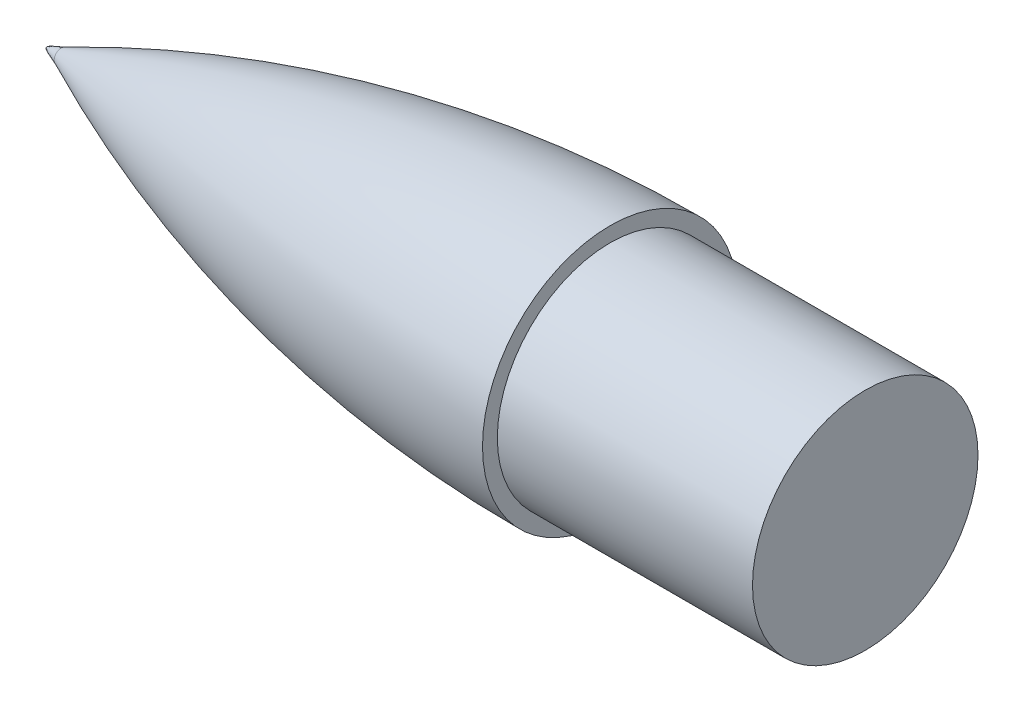
from build123d import *


with BuildPart() as part:
    # Sketch2 → Revolve1 (revolve)
    with BuildSketch(Plane.XY, mode=Mode.PRIVATE) as revolve1_sk:
        with BuildLine():
            Line((0, 441.26744186), (0, 436.26744186))
            Line((0, 436.26744186), (86, 436.26744186))
            Line((86, 436.26744186), (86, 398.26744186))
            Line((86, 398.26744186), (81, 398.26744186))
            Line((81, 398.26744186), (81, 431.26744186))
            Line((81, 431.26744186), (-5, 431.26744186))
            Line((-5, 431.26744186), (-5, 436.23878877))
            ThreePointArc((-5, 436.23878877), (-93.487892601, 426.132954328), (-178.079548465, 398.26744186))
            Line((-178.079548465, 398.26744186), (-190, 398.26744186))
            ThreePointArc((-190, 398.26744186), (-97.402515368, 430.38320744), (0, 441.26744186))
        make_face()
    revolve(revolve1_sk.sketch.rotate(Axis((-190, 398.26744186, 0), (-1, 0, 0)), 90), axis=Axis((-190, 398.26744186, 0), (-1, 0, 0)))

    # Sketch3 → Cut-Revolve1 (revolve, cut)
    with BuildSketch(Plane.XY, mode=Mode.PRIVATE) as cut_revolve1_sk:
        with BuildLine():
            Line((-190, 398.26744186), (-185, 398.26744186))
            Line((-185, 398.26744186), (-185, 400.614472088))
            ThreePointArc((-185, 400.614472088), (-187.503672331, 399.448780332), (-190, 398.26744186))
        make_face()
    revolve(cut_revolve1_sk.sketch.rotate(Axis((-190, 398.26744186, 0), (1, 0, 0)), 180), axis=Axis((-190, 398.26744186, 0), (1, 0, 0)), mode=Mode.SUBTRACT)

    # Sketch4 → Revolve2 (revolve)
    with BuildSketch(Plane.XY, mode=Mode.PRIVATE) as revolve2_sk:
        with BuildLine():
            Line((-185, 398.26744186), (-190, 398.26744186))
            add(Edge.make_bspline(
                [(-185, 400.614472088), (-188.204291585, 399.407953228), (-189.935479126, 398.837697544), (-190, 398.26744186)],
                knots=[0, 0, 0, 0, 0.5, 0.5, 0.5, 0.5], degree=3))
            Line((-185, 400.614472088), (-185, 398.26744186))
        make_face()
    revolve(revolve2_sk.sketch.rotate(Axis((-185, 398.26744186, 0), (-1, 0, 0)), 180), axis=Axis((-185, 398.26744186, 0), (-1, 0, 0)))


solid = part.part
